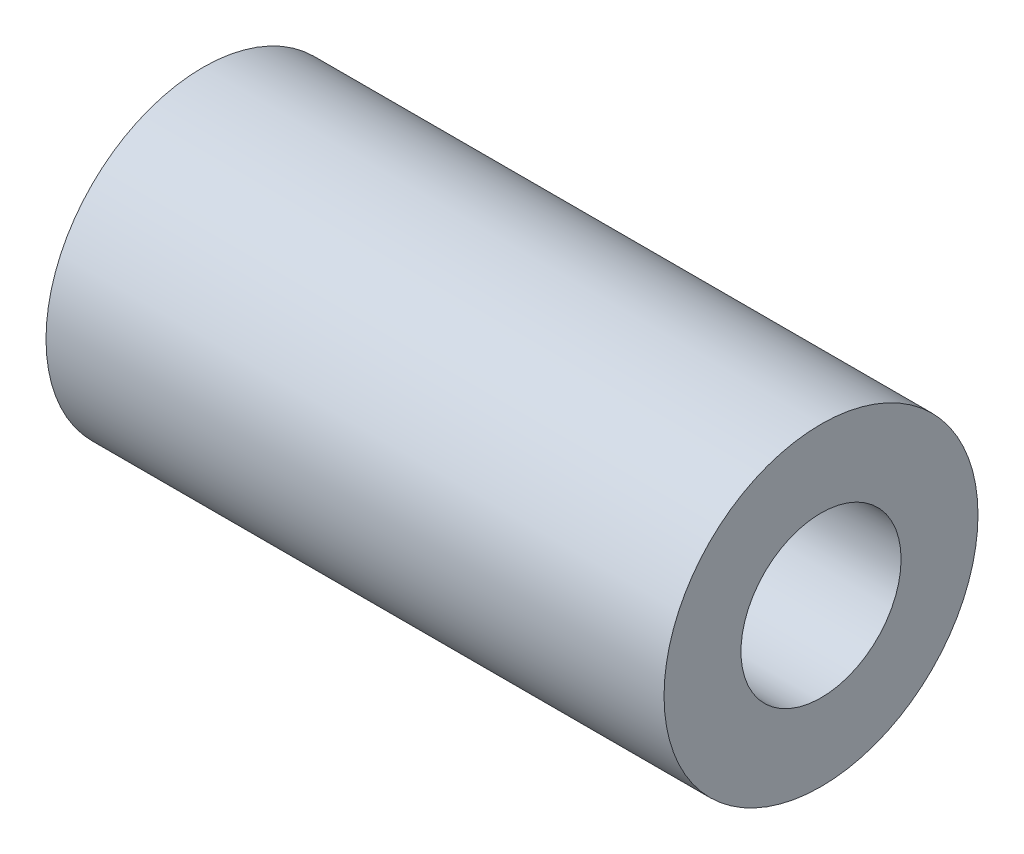
from build123d import *

# Parameters (mm, degrees)
SKETCH1_R           = 6.35
SKETCH1_R_2         = 3.2385
BOSS_EXTRUDE1_DEPTH = 25


with BuildPart() as part:
    # Sketch1 → Boss-Extrude1 (new body)
    with BuildSketch(Plane(origin=(0, 0, 0), x_dir=(0, 0, -1), z_dir=(1, 0, 0))):
        Circle(SKETCH1_R)
        Circle(SKETCH1_R_2, mode=Mode.SUBTRACT)
    extrude(amount=BOSS_EXTRUDE1_DEPTH)


solid = part.part
